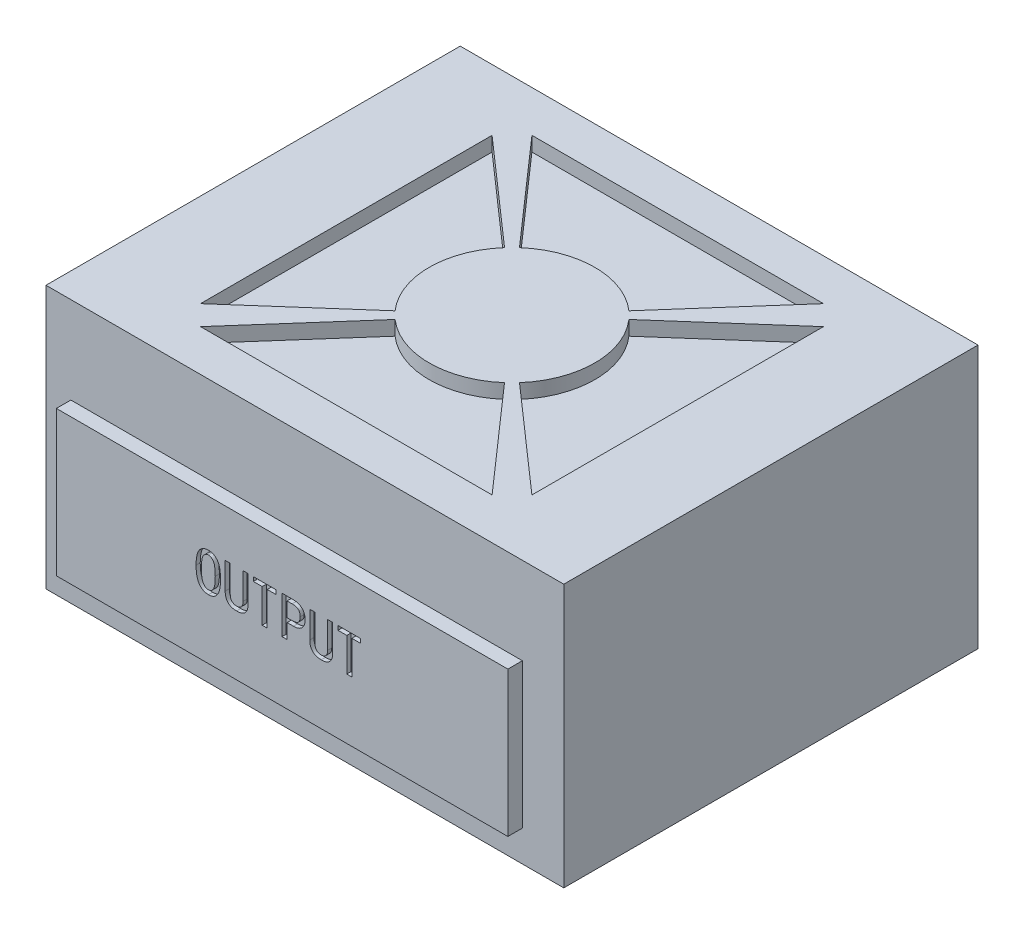
from build123d import *

# Parameters (mm, degrees)
SKETCH_1_W             = 125
SKETCH_1_H             = 100
EXTRUDE_1_DEPTH        = 63.5
SKETCH_2_W             = 109
SKETCH_2_H             = 35
EXTRUDE_2_DEPTH        = 3.5
CUT_EXTRUDE_1_DEPTH    = 3.5
CUT_EXTRUDE_2_DEPTH    = 1
SKETCH_5_W             = 31
SKETCH_5_H             = 24
EXTRUDE_3_DEPTH        = 3.2
SKETCH_6_W             = 1.5
SKETCH_6_H             = 3
CUT_EXTRUDE_3_DEPTH    = 20
SKETCH_7_W             = 21
SKETCH_7_H             = 10
EXTRUDE_4_DEPTH        = 2.3
EXTRUDE_5_DEPTH        = 4.2
HOLE_WIZARD_M3_1_D     = 2.5
HOLE_WIZARD_M3_1_DEPTH = 8.5
HOLE_WIZARD_M3_1_TIP   = 0.751075774
CUT_EXTRUDE_4_DEPTH    = 1


with BuildPart() as part:
    # 草图1 → 凸台-拉伸1 (new body)
    with BuildSketch(Plane(origin=(0, 0, 0), x_dir=(1, 0, 0), z_dir=(0, 1, 0))):
        Rectangle(SKETCH_1_W, SKETCH_1_H)
    extrude(amount=EXTRUDE_1_DEPTH)

    # 草图2 → 凸台-拉伸2 (add)
    with BuildSketch(Plane.XY.offset(50)):
        with Locations((-2, 25)):
            Rectangle(SKETCH_2_W, SKETCH_2_H)
    extrude(amount=EXTRUDE_2_DEPTH)

    # 草图3 → 切除-拉伸1 (cut)
    with BuildSketch(Plane(origin=(0, 63.5, 0), x_dir=(1, 0, 0), z_dir=(0, 1, 0))):
        with BuildLine():
            Line((-35.190604476, 40), (35.190604476, 40))
            Line((35.190604476, 40), (13.21057002, 15.016019437))
            ThreePointArc((13.21057002, 15.016019437), (0, 20), (-13.21057002, 15.016019437))
            Line((-13.21057002, 15.016019437), (-35.190604476, 40))
        make_face()
        with BuildLine():
            Line((15.016019437, 13.21057002), (40, 35.190604476))
            Line((40, 35.190604476), (40, -35.190604476))
            Line((40, -35.190604476), (15.016019437, -13.21057002))
            ThreePointArc((15.016019437, -13.21057002), (20, 0), (15.016019437, 13.21057002))
        make_face()
        with BuildLine():
            Line((13.21057002, -15.016019437), (35.190604476, -40))
            Line((35.190604476, -40), (-35.190604476, -40))
            Line((-35.190604476, -40), (-13.21057002, -15.016019437))
            ThreePointArc((-13.21057002, -15.016019437), (0, -20), (13.21057002, -15.016019437))
        make_face()
        with BuildLine():
            Line((-15.016019437, -13.21057002), (-40, -35.190604476))
            Line((-40, -35.190604476), (-40, 35.190604476))
            Line((-40, 35.190604476), (-15.016019437, 13.21057002))
            ThreePointArc((-15.016019437, 13.21057002), (-20, 0), (-15.016019437, -13.21057002))
        make_face()
    extrude(amount=-CUT_EXTRUDE_1_DEPTH, mode=Mode.SUBTRACT)

    # 草图4 → 切除-拉伸2 (cut)
    with BuildSketch(Plane(origin=(0, 0, -50), x_dir=(-1, 0, 0), z_dir=(0, 0, -1))):
        with BuildLine():
            Line((47.5, 2), (-12.5, 2))
            ThreePointArc((-12.5, 2), (-15, 4.5), (-12.5, 7))
            Line((-12.5, 7), (47.5, 7))
            ThreePointArc((47.5, 7), (50, 4.5), (47.5, 2))
        make_face()
        with BuildLine():
            Line((47.5, 14.785714286), (-12.5, 14.785714286))
            ThreePointArc((-12.5, 14.785714286), (-15, 12.285714286), (-12.5, 9.785714286))
            Line((-12.5, 9.785714286), (47.5, 9.785714286))
            ThreePointArc((47.5, 9.785714286), (50, 12.285714286), (47.5, 14.785714286))
        make_face()
        with BuildLine():
            Line((47.5, 22.571428571), (-12.5, 22.571428571))
            ThreePointArc((-12.5, 22.571428571), (-15, 20.071428571), (-12.5, 17.571428571))
            Line((-12.5, 17.571428571), (47.5, 17.571428571))
            ThreePointArc((47.5, 17.571428571), (50, 20.071428571), (47.5, 22.571428571))
        make_face()
        with BuildLine():
            Line((47.5, 30.357142857), (-12.5, 30.357142857))
            ThreePointArc((-12.5, 30.357142857), (-15, 27.857142857), (-12.5, 25.357142857))
            Line((-12.5, 25.357142857), (47.5, 25.357142857))
            ThreePointArc((47.5, 25.357142857), (50, 27.857142857), (47.5, 30.357142857))
        make_face()
        with BuildLine():
            Line((47.5, 38.142857143), (-12.5, 38.142857143))
            ThreePointArc((-12.5, 38.142857143), (-15, 35.642857143), (-12.5, 33.142857143))
            Line((-12.5, 33.142857143), (47.5, 33.142857143))
            ThreePointArc((47.5, 33.142857143), (50, 35.642857143), (47.5, 38.142857143))
        make_face()
        with BuildLine():
            Line((47.5, 45.928571429), (-12.5, 45.928571429))
            ThreePointArc((-12.5, 45.928571429), (-15, 43.428571429), (-12.5, 40.928571429))
            Line((-12.5, 40.928571429), (47.5, 40.928571429))
            ThreePointArc((47.5, 40.928571429), (50, 43.428571429), (47.5, 45.928571429))
        make_face()
        with BuildLine():
            Line((47.5, 53.714285714), (-12.5, 53.714285714))
            ThreePointArc((-12.5, 53.714285714), (-15, 51.214285714), (-12.5, 48.714285714))
            Line((-12.5, 48.714285714), (47.5, 48.714285714))
            ThreePointArc((47.5, 48.714285714), (50, 51.214285714), (47.5, 53.714285714))
        make_face()
        with BuildLine():
            Line((47.5, 61.5), (-12.5, 61.5))
            ThreePointArc((-12.5, 61.5), (-15, 59), (-12.5, 56.5))
            Line((-12.5, 56.5), (47.5, 56.5))
            ThreePointArc((47.5, 56.5), (50, 59), (47.5, 61.5))
        make_face()
    extrude(amount=-CUT_EXTRUDE_2_DEPTH, mode=Mode.SUBTRACT)

    # 草图5 → 凸台-拉伸3 (add)
    with BuildSketch(Plane(origin=(0, 0, -50), x_dir=(-1, 0, 0), z_dir=(0, 0, -1))):
        with Locations((-36.5, 33)):
            Rectangle(SKETCH_5_W, SKETCH_5_H)
    extrude(amount=EXTRUDE_3_DEPTH)

    # 草图6 → 切除-拉伸3 (cut)
    with BuildSketch(Plane(origin=(0, 0, -53.2), x_dir=(-1, 0, 0), z_dir=(0, 0, -1))):
        Polygon((-23.5, 23.5), (-23.5, 36.5), (-29.5, 42.5), (-43.5, 42.5), (-49.5, 36.5), (-49.5, 23.5), align=None)
        with Locations((-28.25, 28)):
            Rectangle(SKETCH_6_W, SKETCH_6_H, mode=Mode.SUBTRACT)
        with Locations((-36.5, 38)):
            Rectangle(SKETCH_6_W, SKETCH_6_H, mode=Mode.SUBTRACT)
        with Locations((-44.75, 28)):
            Rectangle(SKETCH_6_W, SKETCH_6_H, mode=Mode.SUBTRACT)
    extrude(amount=-CUT_EXTRUDE_3_DEPTH, mode=Mode.SUBTRACT)

    # 草图7 → 凸台-拉伸4 (add)
    with BuildSketch(Plane(origin=(0, 0, -50), x_dir=(-1, 0, 0), z_dir=(0, 0, -1))):
        with Locations((-36.5, 16)):
            Rectangle(SKETCH_7_W, SKETCH_7_H)
    extrude(amount=EXTRUDE_4_DEPTH)

    # 草图8 → 凸台-拉伸5 (add)
    with BuildSketch(Plane(origin=(0, 0, -52.3), x_dir=(-1, 0, 0), z_dir=(0, 0, -1))):
        with BuildLine():
            Line((-31.5, 13), (-41.5, 13))
            ThreePointArc((-41.5, 13), (-44, 15.5), (-41.5, 18))
            Line((-41.5, 18), (-31.5, 18))
            ThreePointArc((-31.5, 18), (-29, 15.5), (-31.5, 13))
        make_face()
    extrude(amount=EXTRUDE_5_DEPTH)

    # M3 螺纹孔1
    with Locations(Plane(origin=(0, 0, -50), x_dir=(-1, 0, 0), z_dir=(0, 0, -1))):
        with Locations((56.5, 6), (56.5, 31.75), (56.5, 57.5), (-56.5, 6), (-56.5, 31.75), (-56.5, 57.5)):
            Hole(HOLE_WIZARD_M3_1_D / 2, depth=HOLE_WIZARD_M3_1_DEPTH)
            with Locations((0, 0, -(HOLE_WIZARD_M3_1_DEPTH + HOLE_WIZARD_M3_1_TIP / 2))):  # 118° drill point
                Cone(0, HOLE_WIZARD_M3_1_D / 2, HOLE_WIZARD_M3_1_TIP, mode=Mode.SUBTRACT)

    # 草图13 → 切除-拉伸4 (cut)
    # profile 1 of 6: a face of its own
    with BuildSketch(Plane.XY.offset(53.5)):
        with BuildLine():
            add(Edge.make_bspline(
                [(-16.862969425, 26.590503177), (-16.865129678, 26.389523356), (-16.869298508, 26.001674885), (-16.904051655, 25.442029764), (-16.964597856, 24.92641564), (-17.048177016, 24.454395556), (-17.155306063, 24.025958895), (-17.286233529, 23.64067443), (-17.443557928, 23.299569719), (-17.625675712, 23.000818566), (-17.830384644, 22.74301277), (-18.052507069, 22.519426002), (-18.294693721, 22.33067723), (-18.55594466, 22.175841673), (-18.837060043, 22.056740528), (-19.136849551, 21.972356253), (-19.456163174, 21.919945669), (-19.675788612, 21.913374319), (-19.788278575, 21.910008538)],
                knots=[0, 0, 0, 0, 1.545836505, 2.983136913, 4.310657039, 5.537175887, 6.667851947, 7.704493515, 8.662599122, 9.55136463, 10.389079191, 11.189082316, 11.970061338, 12.744463405, 13.518420627, 14.311409556, 15.135120791, 16, 16, 16, 16], degree=3))
            add(Edge.make_bspline(
                [(-19.788278575, 21.910008538), (-19.900773708, 21.913348732), (-20.120409243, 21.919870127), (-20.44090123, 21.972843988), (-20.743292356, 22.056802554), (-21.028108917, 22.175171304), (-21.292130884, 22.331778913), (-21.539734828, 22.519088354), (-21.767757773, 22.742784624), (-21.978271446, 23.000553145), (-22.166932425, 23.298704808), (-22.327216595, 23.640928863), (-22.46526891, 24.025293778), (-22.576032452, 24.454095642), (-22.661197452, 24.926362948), (-22.723710194, 25.441966357), (-22.760999477, 26.001604), (-22.76480394, 26.389513731), (-22.766775163, 26.590503177)],
                knots=[0, 0, 0, 0, 0.860715957, 1.680462108, 2.47930714, 3.258798976, 4.033804958, 4.822976692, 5.629862064, 6.472991471, 7.365455267, 8.323231869, 9.359903903, 10.487649235, 11.709164083, 13.030896221, 14.461604659, 16, 16, 16, 16], degree=3))
            add(Edge.make_bspline(
                [(-22.766775163, 26.590503177), (-22.764814392, 26.791492475), (-22.761036494, 27.178746687), (-22.723748695, 27.737083112), (-22.661102372, 28.250689629), (-22.576619222, 28.719850026), (-22.464978738, 29.144552153), (-22.32708122, 29.524290631), (-22.168074841, 29.862162822), (-21.977511442, 30.153282923), (-21.767841254, 30.405134596), (-21.538937216, 30.622585028), (-21.292124737, 30.806250037), (-21.027429408, 30.958229729), (-20.743273307, 31.07526671), (-20.440565588, 31.15626979), (-20.120507988, 31.210567989), (-19.900796628, 31.215357556), (-19.788278575, 31.217810378)],
                knots=[0, 0, 0, 0, 1.548230922, 2.98303917, 4.308200808, 5.532550635, 6.652834833, 7.686623778, 8.641401291, 9.522543054, 10.35935634, 11.160886009, 11.949022642, 12.72391454, 13.50644669, 14.309045162, 15.13403228, 16, 16, 16, 16], degree=3))
            add(Edge.make_bspline(
                [(-19.788278575, 31.217810378), (-19.675765324, 31.215332874), (-19.456063341, 31.210495109), (-19.137190501, 31.156753187), (-18.837081814, 31.075326663), (-18.556616951, 30.957571987), (-18.294723731, 30.80734081), (-18.053298156, 30.622271595), (-17.830296386, 30.404902808), (-17.626420762, 30.153037047), (-17.44241589, 29.861261707), (-17.286370754, 29.524551005), (-17.155579858, 29.143886832), (-17.047604726, 28.719540216), (-16.964689719, 28.250638157), (-16.904014669, 27.737018963), (-16.869263368, 27.178675573), (-16.865120077, 26.791482813), (-16.862969425, 26.590503177)],
                knots=[0, 0, 0, 0, 0.870222972, 1.699263968, 2.496006616, 3.272995294, 4.047285334, 4.827112443, 5.621581463, 6.452817072, 7.330064346, 8.285160362, 9.318904812, 10.442120126, 11.67157227, 13.002634169, 14.444161275, 16, 16, 16, 16], degree=3))
        make_face()
        with BuildLine():
            add(Edge.make_bspline(
                [(-18.139467963, 26.590503177), (-18.141031211, 26.768473598), (-18.14402052, 27.108796314), (-18.164973931, 27.59507719), (-18.201179636, 28.033632952), (-18.254152453, 28.424125679), (-18.318649248, 28.767723596), (-18.400818196, 29.062416558), (-18.494966429, 29.310652796), (-18.609606794, 29.511898189), (-18.736133038, 29.67643981), (-18.864800005, 29.818846723), (-19.002036417, 29.939109875), (-19.147103379, 30.035509057), (-19.296783049, 30.114493321), (-19.455347827, 30.166867263), (-19.619212835, 30.202811762), (-19.731611494, 30.20576176), (-19.788278575, 30.207249035)],
                knots=[0, 0, 0, 0, 1.935009416, 3.700208474, 5.290966952, 6.717666284, 7.983429577, 9.088666043, 10.040575683, 10.86236036, 11.596304304, 12.29363804, 12.946461271, 13.574167208, 14.184039162, 14.780089417, 15.384968011, 16, 16, 16, 16], degree=3))
            add(Edge.make_bspline(
                [(-19.788278575, 30.207249035), (-19.844940056, 30.205722761), (-19.957972132, 30.202678049), (-20.123141519, 30.166857256), (-20.28368317, 30.114566167), (-20.435736328, 30.035133749), (-20.584390569, 29.938635618), (-20.727610942, 29.819892234), (-20.859799075, 29.675273352), (-20.994988813, 29.513192269), (-21.114964475, 29.310982536), (-21.215926772, 29.063191574), (-21.301144262, 28.76783476), (-21.370436755, 28.424466835), (-21.424537358, 28.033650635), (-21.462855705, 27.595135392), (-21.486277507, 27.108844322), (-21.488903497, 26.768479596), (-21.490276625, 26.590503177)],
                knots=[0, 0, 0, 0, 0.611089153, 1.219041108, 1.817987105, 2.430269109, 3.065779911, 3.730623558, 4.433151476, 5.17984647, 6.00710797, 6.960941472, 8.063026251, 9.323472721, 10.742001662, 12.323182839, 14.077395506, 16, 16, 16, 16], degree=3))
            add(Edge.make_bspline(
                [(-21.490276625, 26.590503177), (-21.488889847, 26.412527503), (-21.486232642, 26.071508305), (-21.462887537, 25.583899673), (-21.424346938, 25.142789039), (-21.370620257, 24.749309641), (-21.300987707, 24.402703758), (-21.214998073, 24.103165762), (-21.115429782, 23.849011333), (-20.994806629, 23.640674302), (-20.860524262, 23.472408716), (-20.726955384, 23.324007974), (-20.585116881, 23.199197874), (-20.436290182, 23.098506076), (-20.283720897, 23.017524962), (-20.123533487, 22.962296558), (-19.957853455, 22.927763611), (-19.844914358, 22.922972492), (-19.788278575, 22.920569881)],
                knots=[0, 0, 0, 0, 1.904974992, 3.650122658, 5.223805484, 6.643247296, 7.899019683, 9.004487743, 9.975563022, 10.813390195, 11.569780086, 12.276151917, 12.948593274, 13.586073969, 14.195949674, 14.79168842, 15.394065703, 16, 16, 16, 16], degree=3))
            add(Edge.make_bspline(
                [(-19.788278575, 22.920569881), (-19.731637672, 22.922935051), (-19.619332175, 22.927624623), (-19.454951723, 22.962291413), (-19.296747027, 23.017599658), (-19.146532946, 23.098131841), (-19.001286443, 23.198747794), (-18.86549427, 23.32502916), (-18.735377037, 23.471280445), (-18.609828089, 23.64194812), (-18.494519135, 23.849348855), (-18.401721261, 24.103896586), (-18.318798863, 24.402814208), (-18.253977995, 24.749649984), (-18.201363148, 25.142805157), (-18.164942414, 25.583957746), (-18.144062636, 26.071555999), (-18.141043678, 26.412533428), (-18.139467963, 26.590503177)],
                knots=[0, 0, 0, 0, 0.609746698, 1.208983301, 1.801799102, 2.40924424, 3.039088536, 3.699939805, 4.401261932, 5.145395336, 5.978015425, 6.947413619, 8.055962864, 9.316862112, 10.744271275, 12.327239227, 14.08303934, 16, 16, 16, 16], degree=3))
        make_face(mode=Mode.SUBTRACT)
    # profile 2 of 6: a face of its own
    with BuildSketch(Plane.XY.offset(53.5)):
        with BuildLine():
            add(Edge.make_bspline(
                [(-10.21453954, 24.67575537), (-10.216196415, 24.571929082), (-10.219423984, 24.369677037), (-10.251301174, 24.074434726), (-10.305073499, 23.796893635), (-10.374768277, 23.53354993), (-10.469433397, 23.288359926), (-10.584276353, 23.058961205), (-10.721271988, 22.847664438), (-10.87676729, 22.651630949), (-11.05400464, 22.473565881), (-11.260309549, 22.324156893), (-11.487873801, 22.194847717), (-11.740551707, 22.091453747), (-12.015824183, 22.00727565), (-12.316696935, 21.952909777), (-12.640544565, 21.915976223), (-12.864604763, 21.912040527), (-12.980286372, 21.910008538)],
                knots=[0, 0, 0, 0, 1.114057318, 2.17016686, 3.181914251, 4.146156195, 5.0898066, 5.997508409, 6.894781419, 7.787392663, 8.679419473, 9.581522874, 10.512482426, 11.482322563, 12.505662445, 13.596199728, 14.758925122, 16, 16, 16, 16], degree=3))
            add(Edge.make_bspline(
                [(-12.980286372, 21.910008538), (-13.095968704, 21.912038501), (-13.320030302, 21.915970274), (-13.643868138, 21.952931265), (-13.944774702, 22.007202421), (-14.220512581, 22.091881726), (-14.474125887, 22.194461338), (-14.702119789, 22.323478445), (-14.906758504, 22.474878123), (-15.085742719, 22.650924906), (-15.241474819, 22.847165995), (-15.375922193, 23.05958671), (-15.491483772, 23.28822288), (-15.585004891, 23.533949915), (-15.658777081, 23.796279628), (-15.708355666, 24.074749154), (-15.741400429, 24.369624575), (-15.744461699, 24.571911286), (-15.746033204, 24.67575537)],
                knots=[0, 0, 0, 0, 1.240869508, 2.403402497, 3.49375932, 4.516929862, 5.493116046, 6.423921546, 7.320215534, 8.217118663, 9.1095822, 10.00290763, 10.910459234, 11.853953486, 12.819913796, 13.830192254, 14.886127034, 16, 16, 16, 16], degree=3))
            Line((-15.746033204, 24.67575537), (-15.746033204, 31.1114355))
            Line((-15.746033204, 31.1114355), (-14.522722105, 31.1114355))
            Line((-14.522722105, 31.1114355), (-14.522722105, 24.67575537))
            add(Edge.make_bspline(
                [(-14.522722105, 24.67575537), (-14.522155124, 24.602779669), (-14.521059227, 24.461727565), (-14.49661246, 24.258167378), (-14.46836822, 24.068169307), (-14.41906476, 23.894231411), (-14.362193053, 23.732918179), (-14.285644838, 23.589795017), (-14.201277112, 23.458183227), (-14.099536964, 23.34512895), (-13.989969871, 23.243805173), (-13.868844973, 23.158937091), (-13.742305277, 23.082880598), (-13.604364742, 23.024993775), (-13.460722657, 22.975815037), (-13.307406235, 22.946914764), (-13.147190862, 22.922364982), (-13.036865546, 22.921178404), (-12.980286372, 22.920569881)],
                knots=[0, 0, 0, 0, 1.315659406, 2.542990672, 3.696132648, 4.776878556, 5.800314007, 6.775421457, 7.698841572, 8.613938634, 9.511376441, 10.385998327, 11.278101667, 12.169575324, 13.080058421, 14.011877908, 14.98041258, 16, 16, 16, 16], degree=3))
            add(Edge.make_bspline(
                [(-12.980286372, 22.920569881), (-12.923707205, 22.921178408), (-12.8133819, 22.922364993), (-12.653166441, 22.946914721), (-12.499850328, 22.975815189), (-12.356207131, 23.024993223), (-12.218270646, 23.082882614), (-12.091715986, 23.158929618), (-11.970646372, 23.243832755), (-11.860867212, 23.345022063), (-11.759697393, 23.458865658), (-11.672219881, 23.588591901), (-11.59907002, 23.733614165), (-11.541094001, 23.894082434), (-11.493046829, 24.06843922), (-11.460595548, 24.257785882), (-11.440446945, 24.461906303), (-11.43873616, 24.602817899), (-11.437850639, 24.67575537)],
                knots=[0, 0, 0, 0, 1.019461184, 1.987875941, 2.91958006, 3.82995043, 4.721313713, 5.613306601, 6.4878202, 7.385146895, 8.300130658, 9.230025348, 10.199598843, 11.222907583, 12.303519683, 13.45852564, 14.684503486, 16, 16, 16, 16], degree=3))
            Line((-11.437850639, 24.67575537), (-11.437850639, 31.1114355))
            Line((-11.437850639, 31.1114355), (-10.21453954, 31.1114355))
            Line((-10.21453954, 31.1114355), (-10.21453954, 24.67575537))
        make_face()
    # profile 3 of 6: a face of its own
    with BuildSketch(Plane.XY.offset(53.5)):
        Polygon((-3.459734776, 30.100874157), (-5.587232339, 30.100874157), (-5.587232339, 22.016383416), (-6.810543438, 22.016383416), (-6.810543438, 30.100874157), (-8.938041002, 30.100874157), (-8.938041002, 31.1114355), (-3.459734776, 31.1114355), align=None)
    # profile 4 of 6: a face of its own
    with BuildSketch(Plane.XY.offset(53.5)):
        with BuildLine():
            add(Edge.make_bspline(
                [(3.561007183, 28.345688667), (3.558927863, 28.241821928), (3.55487483, 28.039363819), (3.517817408, 27.744322401), (3.462159728, 27.465684961), (3.380838938, 27.202742135), (3.27494865, 26.957135988), (3.145280481, 26.728617304), (2.995145062, 26.515227764), (2.819288971, 26.321705112), (2.625284328, 26.144540874), (2.408105184, 25.995937291), (2.176357696, 25.865430916), (1.923834974, 25.761978196), (1.654463888, 25.67848473), (1.365709828, 25.622924546), (1.060181387, 25.586114414), (0.849875691, 25.582033641), (0.742072912, 25.579941835)],
                knots=[0, 0, 0, 0, 1.113585954, 2.170613098, 3.184453455, 4.157933965, 5.11693774, 6.047298652, 6.971642075, 7.9092259, 8.846809724, 9.782672554, 10.725321584, 11.694538078, 12.703744356, 13.745194327, 14.844185754, 16, 16, 16, 16], degree=3))
            Line((0.742072912, 25.579941835), (-0.800362822, 25.579941835))
            Line((-0.800362822, 25.579941835), (-0.800362822, 22.016383416))
            Line((-0.800362822, 22.016383416), (-2.023673921, 22.016383416))
            Line((-2.023673921, 22.016383416), (-2.023673921, 31.1114355))
            Line((-2.023673921, 31.1114355), (0.742072912, 31.1114355))
            add(Edge.make_bspline(
                [(0.742072912, 31.1114355), (0.849868291, 31.109321118), (1.060159549, 31.105196304), (1.365790407, 31.068698589), (1.653995617, 31.012071201), (1.924714958, 30.932490324), (2.175833151, 30.825310193), (2.408184783, 30.695639971), (2.625261673, 30.54678239), (2.819300093, 30.369688799), (2.995123401, 30.176137516), (3.145355144, 29.962791517), (3.274368667, 29.73465007), (3.38173405, 29.489630825), (3.461722395, 29.226201729), (3.517906317, 28.947085043), (3.554850803, 28.652005378), (3.558919716, 28.449552648), (3.561007183, 28.345688667)],
                knots=[0, 0, 0, 0, 1.155744957, 2.254670502, 3.296058039, 4.30316213, 5.275054544, 6.217647064, 7.153453791, 8.090981409, 9.028509026, 9.952797036, 10.883102175, 11.835587515, 12.815737448, 13.829517027, 14.886480804, 16, 16, 16, 16], degree=3))
        make_face()
        with BuildLine():
            add(Edge.make_bspline(
                [(2.337696084, 28.345688667), (2.336124396, 28.426503983), (2.333102739, 28.581875796), (2.31186861, 28.805240491), (2.275330243, 29.009254234), (2.221778854, 29.193118036), (2.156413022, 29.358430659), (2.071660449, 29.501762072), (1.976131589, 29.628126466), (1.860592723, 29.732228102), (1.730129817, 29.818147155), (1.588659682, 29.896232921), (1.429964989, 29.958582054), (1.257761377, 30.012257475), (1.069371898, 30.049961801), (0.867640643, 30.080142222), (0.650452927, 30.097710114), (0.50046221, 30.099796124), (0.422948277, 30.100874157)],
                knots=[0, 0, 0, 0, 1.283231691, 2.467082286, 3.559210814, 4.568987994, 5.504250366, 6.37341159, 7.205635433, 8.010158275, 8.828615604, 9.682442496, 10.571210164, 11.531028497, 12.54333288, 13.618353121, 14.769185068, 16, 16, 16, 16], degree=3))
            Line((0.422948277, 30.100874157), (-0.800362822, 30.100874157))
            Line((-0.800362822, 30.100874157), (-0.800362822, 26.590503177))
            Line((-0.800362822, 26.590503177), (0.422948277, 26.590503177))
            add(Edge.make_bspline(
                [(0.422948277, 26.590503177), (0.50046221, 26.59158121), (0.650452927, 26.59366722), (0.867640643, 26.611235112), (1.069371898, 26.641415534), (1.257761377, 26.679119859), (1.429964989, 26.732795281), (1.588659682, 26.795144414), (1.730129817, 26.87323018), (1.860592723, 26.959149233), (1.976131589, 27.063250869), (2.071660449, 27.189615262), (2.156413022, 27.332946676), (2.221778854, 27.498259298), (2.275330243, 27.682123101), (2.31186861, 27.886136843), (2.333102739, 28.109501538), (2.336124396, 28.264873351), (2.337696084, 28.345688667)],
                knots=[0, 0, 0, 0, 1.230814932, 2.381646879, 3.45666712, 4.468971503, 5.428789836, 6.317557504, 7.171384396, 7.989841725, 8.794364567, 9.62658841, 10.495749634, 11.431012006, 12.440789186, 13.532917714, 14.716768309, 16, 16, 16, 16], degree=3))
        make_face(mode=Mode.SUBTRACT)
    # profile 5 of 6: a face of its own
    with BuildSketch(Plane.XY.offset(53.5)):
        with BuildLine():
            add(Edge.make_bspline(
                [(10.209437069, 24.67575537), (10.207780193, 24.571929082), (10.204552624, 24.369677037), (10.172675434, 24.074434726), (10.118903109, 23.796893635), (10.049208331, 23.53354993), (9.954543212, 23.288359926), (9.839700255, 23.058961205), (9.70270462, 22.847664438), (9.547209318, 22.651630949), (9.369971968, 22.473565881), (9.163667059, 22.324156893), (8.936102807, 22.194847717), (8.683424901, 22.091453747), (8.408152425, 22.00727565), (8.107279673, 21.952909777), (7.783432043, 21.915976223), (7.559371845, 21.912040527), (7.443690236, 21.910008538)],
                knots=[0, 0, 0, 0, 1.114057318, 2.17016686, 3.181914251, 4.146156195, 5.0898066, 5.997508409, 6.894781419, 7.787392663, 8.679419473, 9.581522874, 10.512482426, 11.482322563, 12.505662445, 13.596199728, 14.758925122, 16, 16, 16, 16], degree=3))
            add(Edge.make_bspline(
                [(7.443690236, 21.910008538), (7.328007904, 21.912038501), (7.103946306, 21.915970274), (6.78010847, 21.952931265), (6.479201906, 22.007202421), (6.203464027, 22.091881726), (5.949850721, 22.194461338), (5.721856819, 22.323478445), (5.517218104, 22.474878123), (5.338233889, 22.650924906), (5.182501789, 22.847165995), (5.048054415, 23.05958671), (4.932492836, 23.28822288), (4.838971717, 23.533949915), (4.765199527, 23.796279628), (4.715620943, 24.074749154), (4.682576179, 24.369624575), (4.67951491, 24.571911286), (4.677943404, 24.67575537)],
                knots=[0, 0, 0, 0, 1.240869508, 2.403402497, 3.49375932, 4.516929862, 5.493116046, 6.423921546, 7.320215534, 8.217118663, 9.1095822, 10.00290763, 10.910459234, 11.853953486, 12.819913796, 13.830192254, 14.886127034, 16, 16, 16, 16], degree=3))
            Line((4.677943404, 24.67575537), (4.677943404, 31.1114355))
            Line((4.677943404, 31.1114355), (5.901254503, 31.1114355))
            Line((5.901254503, 31.1114355), (5.901254503, 24.67575537))
            add(Edge.make_bspline(
                [(5.901254503, 24.67575537), (5.901821484, 24.602779669), (5.902917381, 24.461727565), (5.927364148, 24.258167378), (5.955608388, 24.068169307), (6.004911848, 23.894231411), (6.061783555, 23.732918179), (6.13833177, 23.589795017), (6.222699496, 23.458183227), (6.324439644, 23.34512895), (6.434006737, 23.243805173), (6.555131636, 23.158937091), (6.681671331, 23.082880598), (6.819611866, 23.024993775), (6.963253951, 22.975815037), (7.116570373, 22.946914764), (7.276785746, 22.922364982), (7.387111063, 22.921178404), (7.443690236, 22.920569881)],
                knots=[0, 0, 0, 0, 1.315659406, 2.542990672, 3.696132648, 4.776878556, 5.800314007, 6.775421457, 7.698841572, 8.613938634, 9.511376441, 10.385998327, 11.278101667, 12.169575324, 13.080058421, 14.011877908, 14.98041258, 16, 16, 16, 16], degree=3))
            add(Edge.make_bspline(
                [(7.443690236, 22.920569881), (7.500269404, 22.921178408), (7.610594708, 22.922364993), (7.770810167, 22.946914721), (7.92412628, 22.975815189), (8.067769477, 23.024993223), (8.205705962, 23.082882614), (8.332260622, 23.158929618), (8.453330236, 23.243832755), (8.563109397, 23.345022063), (8.664279215, 23.458865658), (8.751756727, 23.588591901), (8.824906588, 23.733614165), (8.882882607, 23.894082434), (8.93092978, 24.06843922), (8.963381061, 24.257785882), (8.983529663, 24.461906303), (8.985240448, 24.602817899), (8.98612597, 24.67575537)],
                knots=[0, 0, 0, 0, 1.019461184, 1.987875941, 2.91958006, 3.82995043, 4.721313713, 5.613306601, 6.4878202, 7.385146895, 8.300130658, 9.230025348, 10.199598843, 11.222907583, 12.303519683, 13.45852564, 14.684503486, 16, 16, 16, 16], degree=3))
            Line((8.98612597, 24.67575537), (8.98612597, 31.1114355))
            Line((8.98612597, 31.1114355), (10.209437069, 31.1114355))
            Line((10.209437069, 31.1114355), (10.209437069, 24.67575537))
        make_face()
    # profile 6 of 6: a face of its own
    with BuildSketch(Plane.XY.offset(53.5)):
        Polygon((16.964241832, 30.100874157), (14.836744269, 30.100874157), (14.836744269, 22.016383416), (13.61343317, 22.016383416), (13.61343317, 30.100874157), (11.485935607, 30.100874157), (11.485935607, 31.1114355), (16.964241832, 31.1114355), align=None)
    extrude(amount=-CUT_EXTRUDE_4_DEPTH, mode=Mode.SUBTRACT)


solid = part.part
